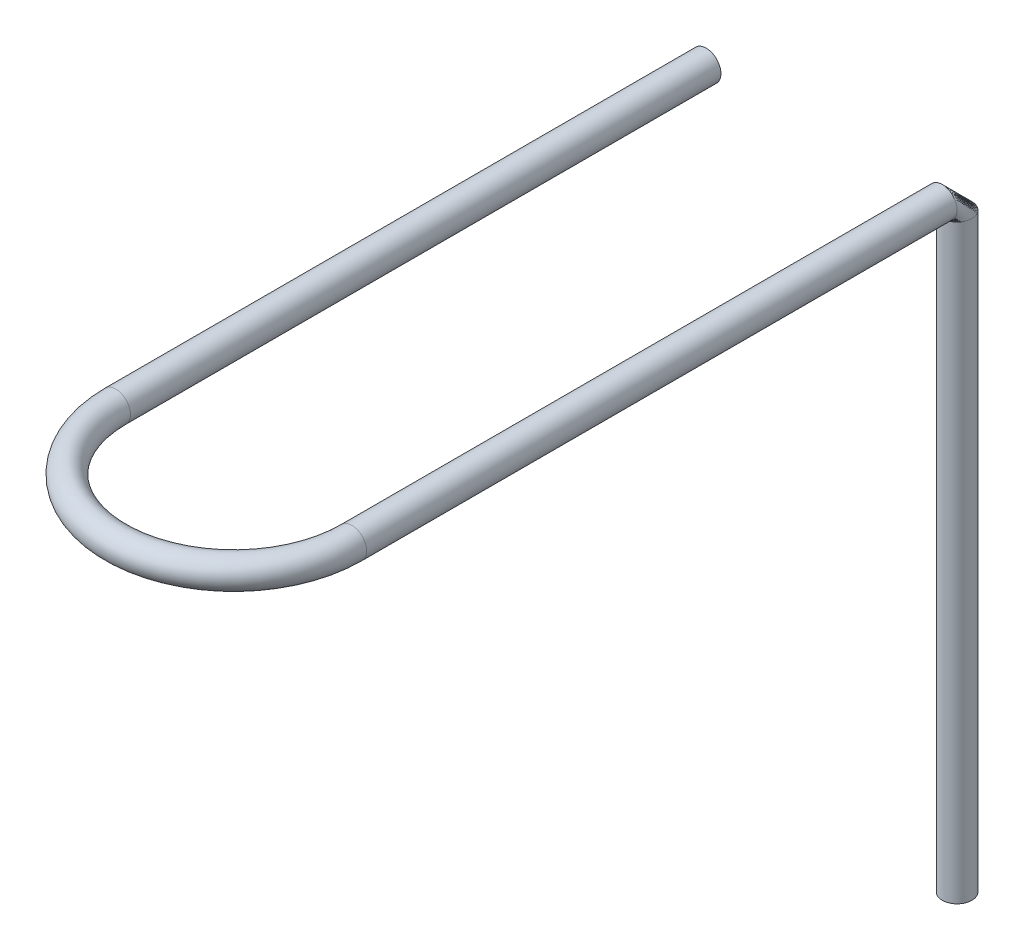
from build123d import *

# Parameters (mm, degrees)
VARREDURA1_PROFILE_R = 0.25
VARREDURA2_PROFILE_R = 0.25


with BuildPart() as part:
    # Varredura1: sweep along a path in Esboço1
    with BuildLine(Plane(origin=(0, 0, 0), x_dir=(1, 0, 0), z_dir=(0, 1, 0))) as varredura1_path:
        Line((0, 0), (0, -10))
        ThreePointArc((0, -10), (-2, -12), (-4, -10))
        Line((-4, -10), (-4, 0))
    # Varredura1 profile (on start of the path) → Varredura1 (sweep)
    with BuildSketch(Plane.XY):
        Circle(VARREDURA1_PROFILE_R)
    sweep(path=varredura1_path.line)

    # Varredura2: sweep along a path in Esboço2
    with BuildLine(Plane(origin=(0, 0, 0), x_dir=(0, 0, -1), z_dir=(1, 0, 0))) as varredura2_path:
        Line((0.25, -10.25), (0.25, -0.25))
        ThreePointArc((0.25, -0.25), (0.176776695, -0.073223305), (0, 0))
    # Varredura2 profile (on start of the path) → Varredura2 (sweep)
    with BuildSketch(Plane(origin=(0, -10.25, -0.25), x_dir=(0, 0, 1), z_dir=(0, 1, 0))):
        Circle(VARREDURA2_PROFILE_R)
    sweep(path=varredura2_path.line)


solid = part.part
